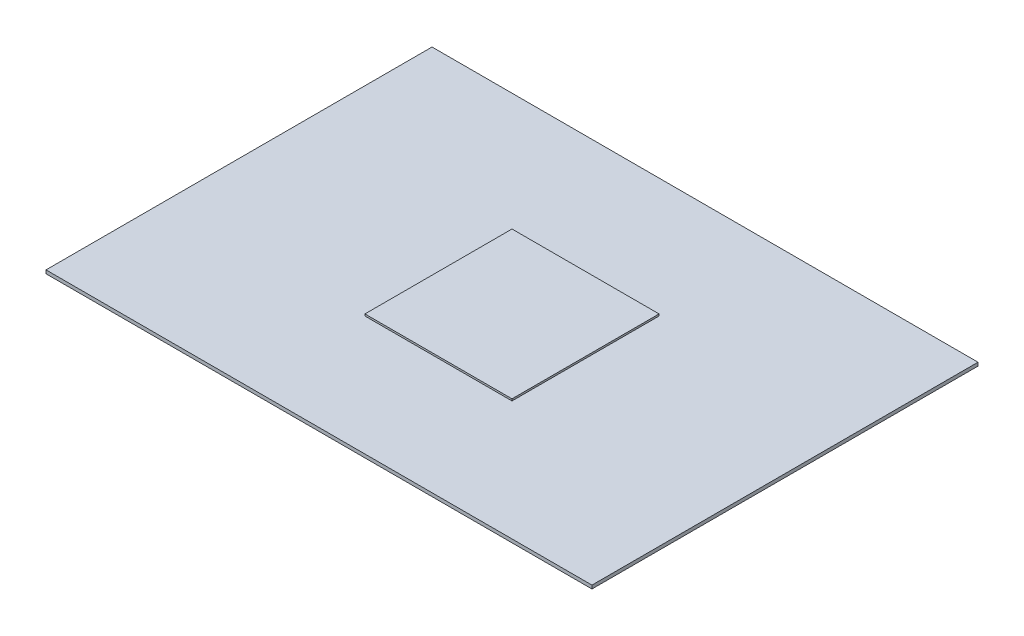
from build123d import *

# Parameters (mm, degrees)
SKETCH_1_W      = 297
SKETCH_1_H      = 210
EXTRUDE_1_DEPTH = 1.851768758
SKETCH_2_W      = 80
SKETCH_2_H      = 80
EXTRUDE_2_DEPTH = 1


with BuildPart() as part:
    # 草图1 → 凸台-拉伸1 (new body)
    with BuildSketch(Plane(origin=(0, 0, 0), x_dir=(1, 0, 0), z_dir=(0, 1, 0))):
        Rectangle(SKETCH_1_W, SKETCH_1_H)
    extrude(amount=EXTRUDE_1_DEPTH)

    # 草图2 → 凸台-拉伸2 (add)
    with BuildSketch(Plane(origin=(0, 1.851768758, 0), x_dir=(1, 0, 0), z_dir=(0, 1, 0))):
        Rectangle(SKETCH_2_W, SKETCH_2_H)
    extrude(amount=EXTRUDE_2_DEPTH)


solid = part.part
